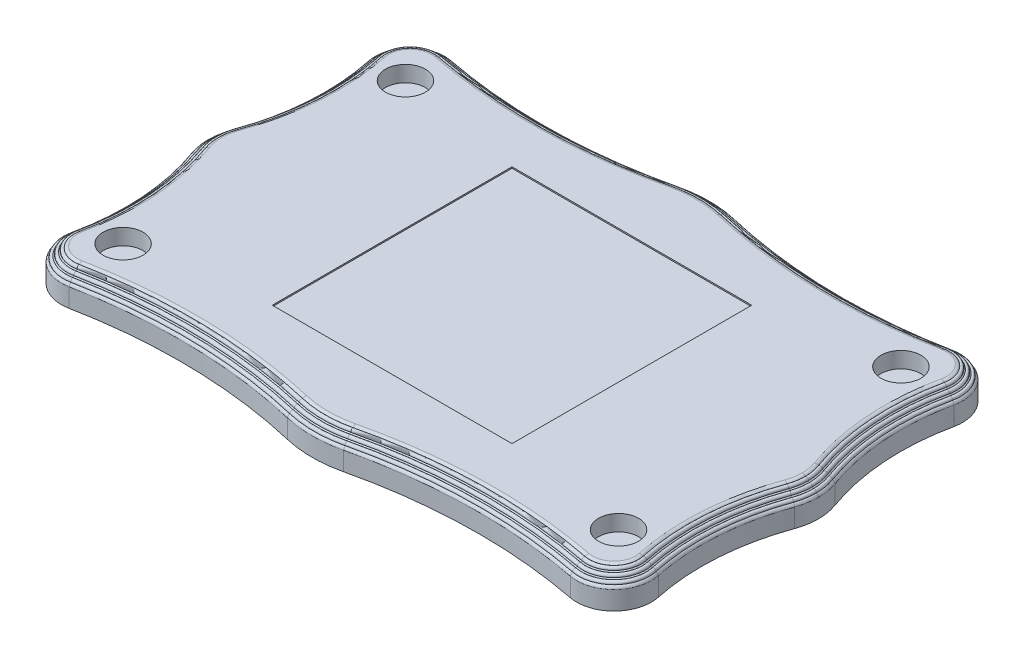
from build123d import *

# Parameters (mm, degrees)
SKETCH1_W              = 115
SKETCH1_H              = 75
BASE_DEPTH             = 6
SKETCH5_W              = 45
SKETCH5_H              = 45
PYRAMID_BASE_CUT_DEPTH = 0.25
SKETCH4_R              = 3.75
POST_HOLE_CUT_DEPTH    = 3


with BuildPart() as part:
    # Sketch1 → Base (new body)
    with BuildSketch(Plane(origin=(0, 0, 0), x_dir=(1, 0, 0), z_dir=(0, 1, 0))):
        Rectangle(SKETCH1_W, SKETCH1_H)
    extrude(amount=BASE_DEPTH)

    # Sweep Cut: sweep along a path in Path
    with BuildLine(Plane(origin=(0, 6, 0), x_dir=(1, 0, 0), z_dir=(0, 1, 0))) as sweep_cut_path:
        ThreePointArc((4.590909091, 33.967813339), (0, 34.5), (-4.590909091, 33.967813339))
        ThreePointArc((-4.590909091, 33.967813339), (-26.049498342, 31.269257036), (-47.596562859, 33.134000848))
        ThreePointArc((-47.596562859, 33.134000848), (-51.212709806, 32.011484521), (-52.272742782, 28.376530361))
        ThreePointArc((-52.272742782, 28.376530361), (-51.358336789, 15.452972347), (-54.016508134, 2.772727273))
        ThreePointArc((-54.016508134, 2.772727273), (-54.5, 0), (-54.016508134, -2.772727273))
        ThreePointArc((-54.016508134, -2.772727273), (-51.358336789, -15.452972347), (-52.272742782, -28.376530361))
        ThreePointArc((-52.272742782, -28.376530361), (-51.212709806, -32.011484521), (-47.596562859, -33.134000848))
        ThreePointArc((-47.596562859, -33.134000848), (-26.049498342, -31.269257036), (-4.590909091, -33.967813339))
        ThreePointArc((-4.590909091, -33.967813339), (0, -34.5), (4.590909091, -33.967813339))
        ThreePointArc((4.590909091, -33.967813339), (26.049498342, -31.269257036), (47.596562859, -33.134000848))
        ThreePointArc((47.596562859, -33.134000848), (51.212709806, -32.011484521), (52.272742782, -28.376530361))
        ThreePointArc((52.272742782, -28.376530361), (51.358336789, -15.452972347), (54.016508134, -2.772727273))
        ThreePointArc((54.016508134, -2.772727273), (54.5, 0), (54.016508134, 2.772727273))
        ThreePointArc((54.016508134, 2.772727273), (51.358336789, 15.452972347), (52.272742782, 28.376530361))
        ThreePointArc((52.272742782, 28.376530361), (51.212709806, 32.011484521), (47.596562859, 33.134000848))
        ThreePointArc((47.596562859, 33.134000848), (26.049498342, 31.269257036), (4.590909091, 33.967813339))
    # Profile → Sweep Cut (sweep, cut)
    with BuildSketch(Plane.XY):
        with BuildLine():
            Line((54.5, 6), (57.5, 6))
            Line((57.5, 6), (67.5, 8))
            Line((67.5, 8), (67.5, 3.5))
            Line((67.5, 3.5), (67.5, -4.5))
            Line((67.5, -4.5), (57.5, -4.5))
            Line((57.5, -4.5), (57.5, 3.5))
            ThreePointArc((57.5, 3.5), (57.371711227, 3.803953735), (57.12703102, 4.025262295))
            ThreePointArc((57.12703102, 4.025262295), (56.999671916, 4.424606299), (56.583908139, 4.477864696))
            ThreePointArc((56.583908139, 4.477864696), (56.488140605, 4.573268726), (56.37703102, 4.650262295))
            ThreePointArc((56.37703102, 4.650262295), (56.249671916, 5.049606299), (55.833908139, 5.102864696))
            ThreePointArc((55.833908139, 5.102864696), (55.738140605, 5.198268726), (55.62703102, 5.275262295))
            ThreePointArc((55.62703102, 5.275262295), (55.499671916, 5.674606299), (55.083908139, 5.727864696))
            ThreePointArc((55.083908139, 5.727864696), (54.822104928, 5.928625651), (54.5, 6))
        make_face()
    sweep(path=sweep_cut_path.line, mode=Mode.SUBTRACT)

    # Sketch5 → Pyramid Base Cut (cut)
    with BuildSketch(Plane(origin=(0, 6, 0), x_dir=(1, 0, 0), z_dir=(0, 1, 0))):
        Rectangle(SKETCH5_W, SKETCH5_H)
    extrude(amount=-PYRAMID_BASE_CUT_DEPTH, mode=Mode.SUBTRACT)

    # Sketch4 → Post Hole Cut (cut)
    with BuildSketch(Plane(origin=(0, 6, 0), x_dir=(1, 0, 0), z_dir=(0, 1, 0))):
        with Locations(Location((-46.5, -26.5, 0), (0, 0, 270))):
            Circle(SKETCH4_R)
        with Locations(Location((46.5, -26.5, 0), (0, 0, 270))):
            Circle(SKETCH4_R)
        with Locations(Location((46.5, 26.5, 0), (0, 0, 270))):
            Circle(SKETCH4_R)
        with Locations(Location((-46.5, 26.5, 0), (0, 0, 270))):
            Circle(SKETCH4_R)
    extrude(amount=-POST_HOLE_CUT_DEPTH, mode=Mode.SUBTRACT)


solid = part.part
